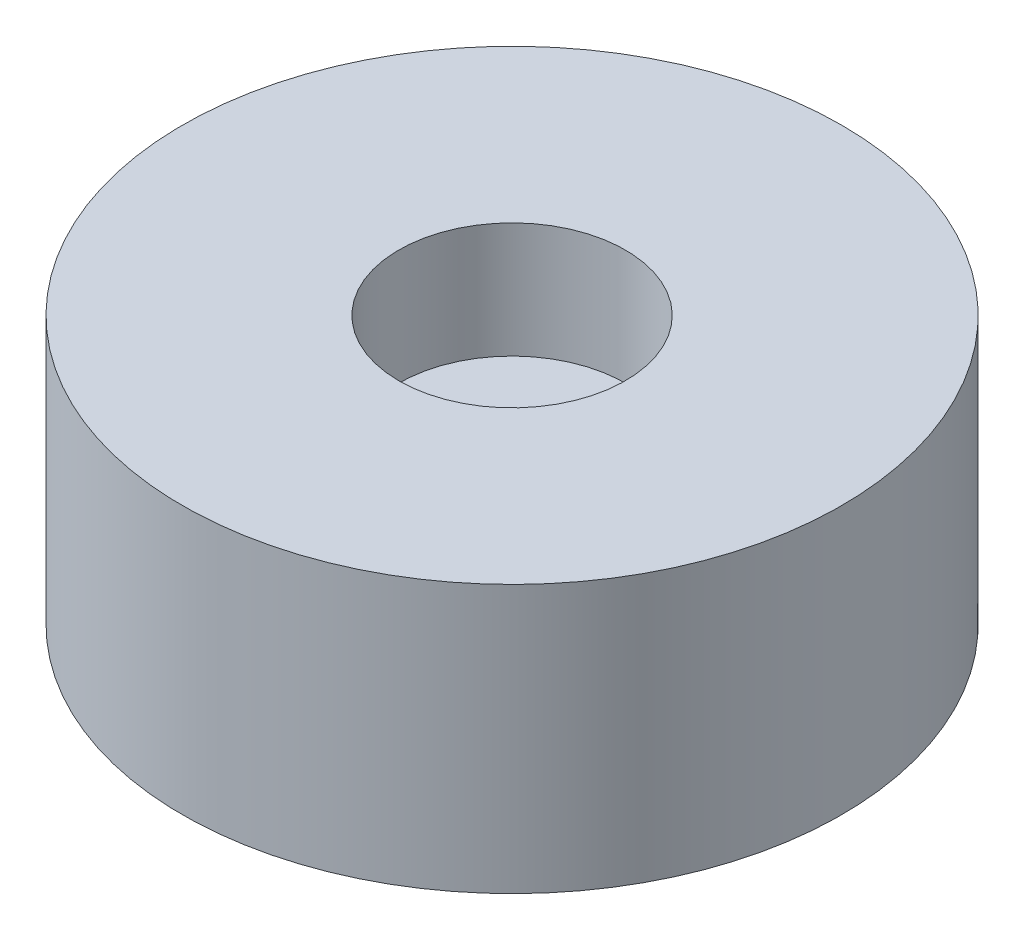
from build123d import *

# Parameters (mm, degrees)
SKETCH1_R           = 8
BOSS_EXTRUDE1_DEPTH = 6.5
SKETCH2_R           = 2.75
CUT_EXTRUDE1_DEPTH  = 2.8
SKETCH3_R           = 1.5
BOSS_EXTRUDE2_DEPTH = 2


with BuildPart() as part:
    # Sketch1 → Boss-Extrude1 (new body)
    with BuildSketch(Plane(origin=(0, 0, 0), x_dir=(1, 0, 0), z_dir=(0, 1, 0))):
        with Locations(Location((0, 0, 0), (0, 0, 90))):
            Circle(SKETCH1_R)
    extrude(amount=BOSS_EXTRUDE1_DEPTH)

    # Sketch2 → Cut-Extrude1 (cut)
    with BuildSketch(Plane(origin=(0, 6.5, 0), x_dir=(1, 0, 0), z_dir=(0, 1, 0))):
        with Locations(Location((0, 0, 0), (0, 0, 270))):
            Circle(SKETCH2_R)
    extrude(amount=-CUT_EXTRUDE1_DEPTH, mode=Mode.SUBTRACT)

    # Sketch3 → Boss-Extrude2 (add)
    with BuildSketch(Plane.XZ):
        with Locations(Location((0, 0, 0), (0, 0, 270))):
            Circle(SKETCH3_R)
    extrude(amount=BOSS_EXTRUDE2_DEPTH)


solid = part.part
